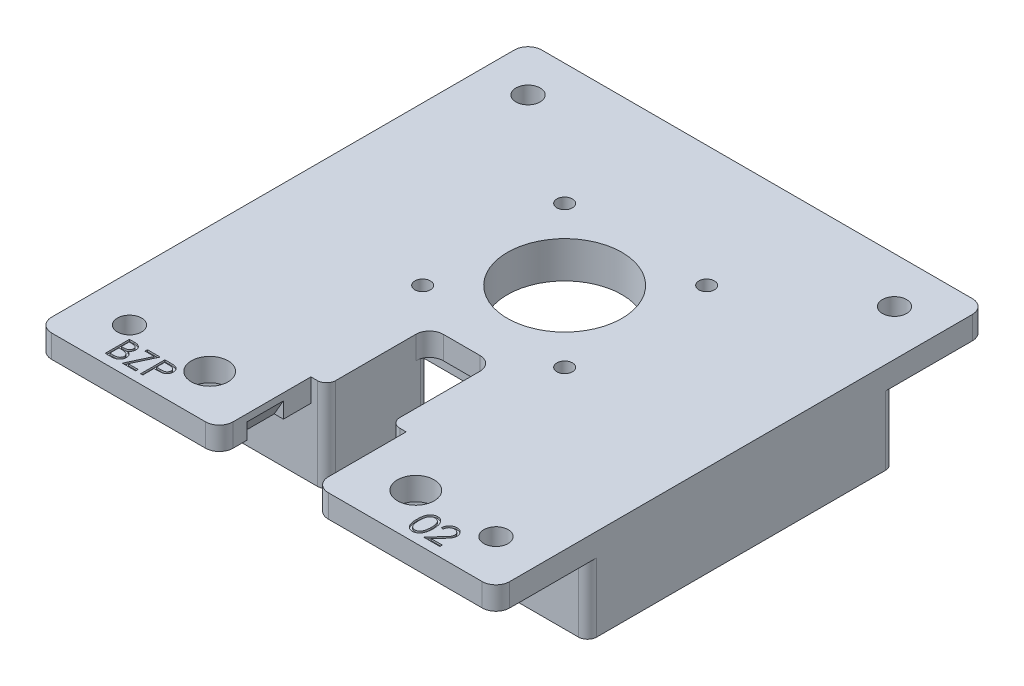
from build123d import *

# Parameters (mm, degrees)
SKETCH2_W               = 100
SKETCH2_H               = 107
BOSS_EXTRUDE1_DEPTH     = 5
CUT_EXTRUDE1_DEPTH      = 147.540096902
CUT_EXTRUDE1_DEPTH_BACK = 20
SKETCH3_R               = 12.5
SKETCH3_R_2             = 1.7
SKETCH3_R_3             = 4
SKETCH12_W              = 42.3
SKETCH12_H              = 42.3
BOSS_EXTRUDE3_DEPTH     = 3
M5_CLEARANCE_HOLE1_D    = 5.3
FILLET1_R               = 3
BOSS_EXTRUDE2_DEPTH     = 15
FILLET3_R               = 3
FILLET4_R               = 2
CUT_EXTRUDE2_DEPTH      = 4
CUT_EXTRUDE2_DEPTH_BACK = 4
CUT_EXTRUDE3_DEPTH      = 0.4
CUT_EXTRUDE4_DEPTH      = 0.4
SKETCH13_R              = 1.7
SKETCH13_R_2            = 12.5
CUT_EXTRUDE5_DEPTH      = 3


with BuildPart() as part:
    # Sketch2 → Boss-Extrude1 (new body)
    with BuildSketch(Plane(origin=(0, 0, 0), x_dir=(1, 0, 0), z_dir=(0, 1, 0))):
        with Locations((50, 53.5)):
            Rectangle(SKETCH2_W, SKETCH2_H)
    extrude(amount=BOSS_EXTRUDE1_DEPTH)

    # Sketch3 → Cut-Extrude1 (cut, two sides: drawn at the far end of the back side and taken through both)
    with BuildSketch(Plane(origin=(0, 5, 0), x_dir=(1, 0, 0), z_dir=(0, 1, 0)).offset(-CUT_EXTRUDE1_DEPTH_BACK)):
        with Locations(Location((50, 65, 0), (0, 0, 90))):
            Circle(SKETCH3_R)
        with Locations(Location((65.5, 49.5, 0), (0, 0, 90))):
            Circle(SKETCH3_R_2)
        with Locations(Location((34.5, 49.5, 0), (0, 0, 90))):
            Circle(SKETCH3_R_2)
        with Locations(Location((65.5, 80.5, 0), (0, 0, 90))):
            Circle(SKETCH3_R_2)
        with Locations(Location((34.5, 80.5, 0), (0, 0, 90))):
            Circle(SKETCH3_R_2)
        with Locations(Location((27.5, 10, 0), (0, 0, 90))):
            Circle(SKETCH3_R_3)
        with Locations(Location((72.5, 10, 0), (0, 0, 90))):
            Circle(SKETCH3_R_3)
        Polygon((39.6, 0), (39.6, 20), (43, 20), (43, 42.5), (57, 42.5), (57, 20), (60.4, 20), (60.4, 0), align=None)
    extrude(amount=CUT_EXTRUDE1_DEPTH + CUT_EXTRUDE1_DEPTH_BACK, mode=Mode.SUBTRACT)

    # Sketch12 → Boss-Extrude3 (add)
    with BuildSketch(Plane.XZ):
        with Locations((50, -65)):
            Rectangle(SKETCH12_W, SKETCH12_H)
    extrude(amount=BOSS_EXTRUDE3_DEPTH)

    # M5 Clearance Hole1 (through all)
    with Locations(Plane(origin=(0, 5, 0), x_dir=(1, 0, 0), z_dir=(0, 1, 0))):
        with Locations((10, 97), (10, 10), (90, 10), (90, 97)):
            Hole(M5_CLEARANCE_HOLE1_D / 2)

    # Fillet1
    fillet1_edges = [part.edges().sort_by_distance(p)[0] for p in [
        (39.6, 2.5, 0),
        (60.4, 2.5, 0),
        (57, 2.5, -42.5),
        (43, 2.5, -42.5),
        (0, 2.5, -107),
        (100, 2.5, -107),
        (100, 2.5, 0),
        (0, 2.5, 0),
    ]]
    fillet(fillet1_edges, radius=FILLET1_R)

    # Sketch7 → Boss-Extrude2 (add)
    with BuildSketch(Plane.XZ):
        Polygon((57, -20), (100, -20), (100, -87), (84, -87), (84, -82), (95, -82), (95, -25), (62, -25), (62, -42.5), (57, -42.5), (57, -25), align=None)
        Polygon((43, -25), (43, -20), (0, -20), (0, -87), (16, -87), (16, -82), (5, -82), (5, -25), (38, -25), (38, -42.5), (43, -42.5), align=None)
    extrude(amount=BOSS_EXTRUDE2_DEPTH)

    # Fillet3
    fillet3_edges = [part.edges().sort_by_distance(p)[0] for p in [
        (62, -7.5, -25),
        (95, -7.5, -25),
        (95, -7.5, -82),
        (5, -7.5, -82),
        (5, -7.5, -25),
        (38, -7.5, -25),
    ]]
    fillet(fillet3_edges, radius=FILLET3_R)

    # Fillet4
    fillet4_edges = [part.edges().sort_by_distance(p)[0] for p in [
        (57, -7.5, -42.5),
        (62, -7.5, -42.5),
        (84, -7.5, -82),
        (84, -7.5, -87),
        (100, -7.5, -87),
        (100, -7.5, -20),
        (43, -7.5, -42.5),
        (0, -7.5, -20),
        (0, -7.5, -87),
        (16, -7.5, -87),
        (16, -7.5, -82),
        (38, -7.5, -42.5),
        (57, -5, -20),
        (43, -5, -20),
    ]]
    fillet(fillet4_edges, radius=FILLET4_R)

    # Sketch9 → Cut-Extrude2 (cut, two sides: drawn at the far end of the back side and taken through both)
    with BuildSketch(Plane.XY.offset(-10).offset(-CUT_EXTRUDE2_DEPTH_BACK)):
        Polygon((39.6, 0), (39.6, 3.464101615), (37.6, 0), align=None)
        Polygon((60.4, 0), (62.4, 0), (60.4, 3.464101615), align=None)
    extrude(amount=CUT_EXTRUDE2_DEPTH + CUT_EXTRUDE2_DEPTH_BACK, mode=Mode.SUBTRACT)

    # Sketch10 → Cut-Extrude3 (cut)
    # profile 1 of 3: a face of its own
    with BuildSketch(Plane(origin=(0, 5, 0), x_dir=(1, 0, 0), z_dir=(0, 1, 0))):
        with BuildLine():
            Line((12.690491453, 7.291666667), (13.722960069, 7.291666667))
            add(Edge.make_bspline(
                [(13.722960069, 7.291666667), (13.773500745, 7.291400949), (13.871461152, 7.290885921), (14.013911975, 7.28289833), (14.147335772, 7.272007068), (14.271771237, 7.254725856), (14.387160871, 7.233874002), (14.493852417, 7.208622447), (14.591506606, 7.178344115), (14.70809372, 7.13019557), (14.841021386, 7.058647447), (14.984952289, 6.952922116), (15.108027746, 6.823605178), (15.214142773, 6.677732592), (15.298508752, 6.517265413), (15.359543285, 6.346028306), (15.398184358, 6.166229958), (15.4021583, 6.042793249), (15.404166667, 5.980410323)],
                knots=[0, 0, 0, 0, 1.001505555, 1.941167018, 2.826882275, 3.653841531, 4.429895133, 5.150066043, 5.825578002, 6.45369114, 7.647487171, 8.808567382, 9.977351308, 11.170798116, 12.373658725, 13.556498008, 14.765093433, 16, 16, 16, 16], degree=3))
            add(Edge.make_bspline(
                [(15.404166667, 5.980410323), (15.402513824, 5.92197134), (15.399265834, 5.807133228), (15.368207138, 5.639169515), (15.31958327, 5.479283743), (15.251993191, 5.328059423), (15.164148507, 5.188913365), (15.060041287, 5.060723093), (14.934437073, 4.948916138), (14.840331222, 4.886409607), (14.792529714, 4.854659121)],
                knots=[0, 0, 0, 0, 1.044552857, 2.05264487, 3.044412934, 4.028983338, 5.005914585, 5.980388656, 6.974128949, 8, 8, 8, 8], degree=3))
            add(Edge.make_bspline(
                [(14.792529714, 4.854659121), (14.852643694, 4.831579897), (14.967656629, 4.787423623), (15.125931909, 4.709355719), (15.262297925, 4.624443957), (15.377803134, 4.531716041), (15.476587446, 4.431765815), (15.56284606, 4.323127725), (15.636447661, 4.204384603), (15.699513629, 4.076774496), (15.748724248, 3.941600431), (15.785578294, 3.800130329), (15.806695747, 3.652871478), (15.809700871, 3.552654297), (15.811217949, 3.502061632)],
                knots=[0, 0, 0, 0, 1.27268992, 2.434971085, 3.483601985, 4.442670788, 5.356604649, 6.2567628, 7.179492994, 8.113709626, 9.066344395, 10.018646069, 10.999752585, 12, 12, 12, 12], degree=3))
            add(Edge.make_bspline(
                [(15.811217949, 3.502061632), (15.809741051, 3.450404575), (15.806835212, 3.348767869), (15.785396445, 3.199459511), (15.749096962, 3.05677358), (15.699096538, 2.919787173), (15.633839229, 2.788765303), (15.55442195, 2.663559534), (15.459728991, 2.545427868), (15.353800605, 2.433057628), (15.23396379, 2.332020378), (15.104672113, 2.242038298), (14.96429732, 2.168036514), (14.8151449, 2.105873005), (14.655541708, 2.058388312), (14.486204433, 2.025167873), (14.307279119, 2.002784067), (14.18449771, 2.000943769), (14.121531116, 2)],
                knots=[0, 0, 0, 0, 0.978564426, 1.925352924, 2.850884081, 3.763762016, 4.682927383, 5.618979971, 6.567305752, 7.547517671, 8.540179244, 9.531824382, 10.526200242, 11.540722885, 12.589160233, 13.674978461, 14.80764778, 16, 16, 16, 16], degree=3))
            Line((14.121531116, 2), (12.690491453, 2))
            Line((12.690491453, 2), (12.690491453, 7.291666667))
        make_face()
        with BuildLine():
            Line((13.165384615, 6.748931624), (13.165384615, 5.052884615))
            Line((13.165384615, 5.052884615), (13.484453459, 5.052884615))
            add(Edge.make_bspline(
                [(13.484453459, 5.052884615), (13.531093899, 5.053489261), (13.621212735, 5.054657559), (13.751720198, 5.058004186), (13.872861595, 5.067375038), (13.984427819, 5.076743196), (14.08624318, 5.091975013), (14.178082114, 5.11010596), (14.261385945, 5.129281305), (14.357451686, 5.161892315), (14.46641912, 5.210088324), (14.582583456, 5.284885029), (14.684991523, 5.373973039), (14.771468224, 5.476768898), (14.842242709, 5.58995944), (14.89140035, 5.711738653), (14.924733744, 5.839071471), (14.92774475, 5.926487163), (14.929273504, 5.970870059)],
                knots=[0, 0, 0, 0, 1.156816544, 2.235205308, 3.236616184, 4.169592532, 5.011045266, 5.787822928, 6.49130361, 7.128639758, 8.301311294, 9.436451833, 10.541879658, 11.654887649, 12.756523258, 13.837046038, 14.901820046, 16, 16, 16, 16], degree=3))
            add(Edge.make_bspline(
                [(14.929273504, 5.970870059), (14.92847797, 6.000239975), (14.926917442, 6.057852274), (14.914136854, 6.141837607), (14.89241445, 6.220825185), (14.864513316, 6.295897471), (14.825523275, 6.364707054), (14.77961661, 6.429633076), (14.72415134, 6.488464493), (14.66101826, 6.543451711), (14.588433795, 6.592202366), (14.506441246, 6.63489971), (14.413931306, 6.669281599), (14.312463061, 6.699392924), (14.200474631, 6.720541893), (14.079258342, 6.738160705), (13.947821326, 6.747130446), (13.856887659, 6.74831784), (13.809882479, 6.748931624)],
                knots=[0, 0, 0, 0, 0.91205012, 1.789085906, 2.630437955, 3.453916878, 4.269457761, 5.079663411, 5.91843418, 6.774407191, 7.675494373, 8.627863946, 9.638891023, 10.736472738, 11.911756761, 13.175263542, 14.539845004, 16, 16, 16, 16], degree=3))
            Line((13.809882479, 6.748931624), (13.165384615, 6.748931624))
        make_face(mode=Mode.SUBTRACT)
        with BuildLine():
            Line((13.165384615, 4.510149573), (13.165384615, 2.542735043))
            Line((13.165384615, 2.542735043), (13.84168336, 2.542735043))
            add(Edge.make_bspline(
                [(13.84168336, 2.542735043), (13.890092927, 2.543315232), (13.983395984, 2.544433471), (14.118108558, 2.548084048), (14.242966346, 2.556387845), (14.357399599, 2.569459547), (14.462643974, 2.583638869), (14.55743693, 2.602705924), (14.642546877, 2.624551377), (14.741235414, 2.658318518), (14.852365718, 2.710776277), (14.972124989, 2.789870406), (15.078602723, 2.884097311), (15.169022579, 2.993152384), (15.24312555, 3.111733081), (15.297033203, 3.237440931), (15.330281284, 3.368198812), (15.33430623, 3.457350865), (15.336324786, 3.502061632)],
                knots=[0, 0, 0, 0, 1.160039823, 2.235823828, 3.228722157, 4.157150951, 4.99529583, 5.772374946, 6.472645482, 7.099169577, 8.269452708, 9.405989375, 10.527446681, 11.663510218, 12.788923519, 13.866172445, 14.929861265, 16, 16, 16, 16], degree=3))
            add(Edge.make_bspline(
                [(15.336324786, 3.502061632), (15.335907343, 3.530021802), (15.335079189, 3.585491141), (15.322589926, 3.667006724), (15.304426099, 3.745967271), (15.280944051, 3.822587188), (15.24674557, 3.895481221), (15.206821389, 3.966091044), (15.160010699, 4.034509995), (15.087070115, 4.121009473), (14.980976757, 4.220669719), (14.830229609, 4.318244276), (14.658821491, 4.396935603), (14.534501353, 4.430347907), (14.470280783, 4.447607839)],
                knots=[0, 0, 0, 0, 0.723448775, 1.435228256, 2.130040452, 2.821711965, 3.505591119, 4.210454504, 4.921174351, 5.648778258, 7.137944449, 8.670945889, 10.280296675, 12, 12, 12, 12], degree=3))
            add(Edge.make_bspline(
                [(14.470280783, 4.447607839), (14.444534411, 4.452831597), (14.388710968, 4.464157782), (14.297682841, 4.476113476), (14.193760753, 4.486764936), (14.076704736, 4.49464371), (13.946366691, 4.502787651), (13.802468254, 4.505954821), (13.645597076, 4.509733464), (13.536751466, 4.510007322), (13.480213341, 4.510149573)],
                knots=[0, 0, 0, 0, 0.634451884, 1.375622551, 2.216452059, 3.157844607, 4.20941857, 5.370758133, 6.634282058, 8, 8, 8, 8], degree=3))
            Line((13.480213341, 4.510149573), (13.165384615, 4.510149573))
        make_face(mode=Mode.SUBTRACT)
    # profile 2 of 3: a face of its own
    with BuildSketch(Plane(origin=(0, 5, 0), x_dir=(1, 0, 0), z_dir=(0, 1, 0))):
        Polygon((16.625320513, 6.748931624), (16.625320513, 7.291666667), (19.406837607, 7.291666667), (17.187136084, 2.542735043), (19.338995726, 2.542735043), (19.338995726, 2), (16.421794872, 2), (18.641496394, 6.748931624), align=None)
    # profile 3 of 3: a face of its own
    with BuildSketch(Plane(origin=(0, 5, 0), x_dir=(1, 0, 0), z_dir=(0, 1, 0))):
        with BuildLine():
            Line((20.424465812, 7.291666667), (21.462234575, 7.291666667))
            add(Edge.make_bspline(
                [(21.462234575, 7.291666667), (21.533612969, 7.291588204), (21.670377142, 7.291437867), (21.866493952, 7.286879859), (22.044611046, 7.280791884), (22.20434436, 7.272352593), (22.346185366, 7.262379177), (22.469492235, 7.248390974), (22.575234184, 7.233785528), (22.638592744, 7.218936496), (22.667487981, 7.212164463)],
                knots=[0, 0, 0, 0, 1.415646017, 2.712440637, 3.8905458, 4.950247383, 5.884950622, 6.709939814, 7.411656543, 8, 8, 8, 8], degree=3))
            add(Edge.make_bspline(
                [(22.667487981, 7.212164463), (22.7040663, 7.202152706), (22.776361015, 7.182365105), (22.88053283, 7.142732452), (22.979644002, 7.095739178), (23.074034572, 7.042181555), (23.162544626, 6.979761714), (23.246494712, 6.911009935), (23.325143968, 6.834338873), (23.39805012, 6.750608468), (23.465004516, 6.661224342), (23.522652965, 6.564852161), (23.570923892, 6.463114119), (23.61232479, 6.356080981), (23.642122096, 6.242853944), (23.664569195, 6.124219748), (23.678816822, 6.00019111), (23.68018141, 5.915433929), (23.680876068, 5.872287326)],
                knots=[0, 0, 0, 0, 0.999701418, 1.975846123, 2.934577507, 3.890451536, 4.834027766, 5.787354733, 6.749476667, 7.726910423, 8.712836071, 9.690891519, 10.682875813, 11.679750201, 12.712814741, 13.765529915, 14.8625177, 16, 16, 16, 16], degree=3))
            add(Edge.make_bspline(
                [(23.680876068, 5.872287326), (23.680238914, 5.828778069), (23.678992279, 5.743649267), (23.664030038, 5.619109456), (23.643876058, 5.500094748), (23.612886467, 5.386869031), (23.572298366, 5.280104711), (23.524685382, 5.178170229), (23.467257901, 5.082799773), (23.401271075, 4.993647107), (23.327865689, 4.910628549), (23.247352318, 4.834345705), (23.160056006, 4.765245098), (23.066254187, 4.703171817), (22.965032392, 4.649565299), (22.857925803, 4.601551279), (22.744003452, 4.561227175), (22.665168937, 4.540015058), (22.625086806, 4.529230101)],
                knots=[0, 0, 0, 0, 1.121902311, 2.195077645, 3.232258892, 4.234102512, 5.217864754, 6.176164875, 7.132989551, 8.084763148, 9.034132444, 9.988522005, 10.94243251, 11.903244335, 12.886203696, 13.894208494, 14.929344452, 16, 16, 16, 16], degree=3))
            add(Edge.make_bspline(
                [(22.625086806, 4.529230101), (22.591934765, 4.522180118), (22.51928014, 4.50672967), (22.399623882, 4.48948117), (22.260308834, 4.474758845), (22.101525149, 4.46372022), (21.923415352, 4.454270258), (21.725883094, 4.446758973), (21.50854062, 4.442631694), (21.356940049, 4.442418829), (21.277789463, 4.442307692)],
                knots=[0, 0, 0, 0, 0.601384939, 1.31797006, 2.144135048, 3.087295005, 4.142315834, 5.309527816, 6.595305764, 8, 8, 8, 8], degree=3))
            Line((21.277789463, 4.442307692), (20.899358974, 4.442307692))
            Line((20.899358974, 4.442307692), (20.899358974, 2))
            Line((20.899358974, 2), (20.424465812, 2))
            Line((20.424465812, 2), (20.424465812, 7.291666667))
        make_face()
        with BuildLine():
            Line((20.899358974, 6.748931624), (20.899358974, 4.985042735))
            Line((20.899358974, 4.985042735), (21.825824653, 4.973382412))
            add(Edge.make_bspline(
                [(21.825824653, 4.973382412), (21.871060731, 4.973359032), (21.958388048, 4.973313899), (22.084535671, 4.979339177), (22.201571141, 4.986294744), (22.309134963, 4.996478819), (22.407275626, 5.010874054), (22.496156771, 5.025406086), (22.575089211, 5.04642967), (22.667465385, 5.074737167), (22.770400922, 5.123016241), (22.882384001, 5.19309286), (22.97728715, 5.282417265), (23.059411241, 5.382849819), (23.124583223, 5.494578265), (23.172292878, 5.614122967), (23.200325342, 5.74025793), (23.20408423, 5.826569759), (23.205982906, 5.870167268)],
                knots=[0, 0, 0, 0, 1.160613943, 2.240541288, 3.23993089, 4.169200891, 5.011653406, 5.7853311, 6.478053781, 7.106038997, 8.262395093, 9.384106736, 10.481365981, 11.59014053, 12.70357646, 13.786202915, 14.881775077, 16, 16, 16, 16], degree=3))
            add(Edge.make_bspline(
                [(23.205982906, 5.870167268), (23.204073905, 5.91271002), (23.200279047, 5.997279747), (23.172073158, 6.121223825), (23.124675981, 6.239508759), (23.058973749, 6.349837114), (22.979234184, 6.449908282), (22.886555415, 6.536838463), (22.781155603, 6.606721275), (22.683111254, 6.651826356), (22.596023746, 6.679366117), (22.520380188, 6.698635102), (22.434971668, 6.71401965), (22.339770382, 6.726476993), (22.235514217, 6.737141155), (22.121307479, 6.744377097), (21.997582804, 6.748612632), (21.911690631, 6.748822719), (21.867165799, 6.748931624)],
                knots=[0, 0, 0, 0, 1.120700087, 2.227813068, 3.331159281, 4.466773991, 5.599788987, 6.693661531, 7.80175334, 8.91857717, 9.525282508, 10.207424825, 10.974604443, 11.810962634, 12.737642355, 13.736264703, 14.826523623, 16, 16, 16, 16], degree=3))
            Line((21.867165799, 6.748931624), (20.899358974, 6.748931624))
        make_face(mode=Mode.SUBTRACT)
    extrude(amount=-CUT_EXTRUDE3_DEPTH, mode=Mode.SUBTRACT)

    # Sketch11 → Cut-Extrude4 (cut)
    # profile 1 of 2: a face of its own
    with BuildSketch(Plane(origin=(0, 5, 0), x_dir=(1, 0, 0), z_dir=(0, 1, 0))):
        with BuildLine():
            add(Edge.make_bspline(
                [(78.083012821, 4.643713275), (78.083508753, 4.728527182), (78.084472108, 4.89327942), (78.095189126, 5.133346677), (78.112992322, 5.358560447), (78.137390493, 5.568931511), (78.167081248, 5.764514179), (78.206716567, 5.944785776), (78.251790686, 6.110580657), (78.304030693, 6.262439469), (78.362976517, 6.402408139), (78.427133078, 6.533074812), (78.499046517, 6.654241781), (78.57460685, 6.767842965), (78.65687272, 6.872018789), (78.743503034, 6.968240433), (78.837878966, 7.054284068), (78.936792324, 7.132670739), (79.041138645, 7.201386012), (79.147943628, 7.2619117), (79.257942419, 7.313618642), (79.371435339, 7.35427442), (79.487402301, 7.387855105), (79.606248699, 7.410819348), (79.728170762, 7.425268483), (79.810465907, 7.426649862), (79.852201856, 7.427350427)],
                knots=[0, 0, 0, 0, 1.646270934, 3.197905019, 4.663502075, 6.030701355, 7.308322542, 8.50163776, 9.611534131, 10.641858119, 11.616356847, 12.558055219, 13.465016945, 14.349605745, 15.204443733, 16.039544428, 16.859896111, 17.680448484, 18.487036065, 19.28249412, 20.06191084, 20.843045899, 21.620316918, 22.403196591, 23.190181807, 24, 24, 24, 24], degree=3))
            add(Edge.make_bspline(
                [(79.852201856, 7.427350427), (79.894286449, 7.426612897), (79.977979462, 7.425146182), (80.101714315, 7.411049269), (80.22259062, 7.387658404), (80.340093044, 7.354515978), (80.455186773, 7.313398705), (80.56697158, 7.261862231), (80.676141811, 7.201871562), (80.780962603, 7.1313807), (80.8825847, 7.052788449), (80.978511977, 6.96394489), (81.068753166, 6.8657471), (81.15444083, 6.759245711), (81.233143936, 6.642398023), (81.308094244, 6.517236333), (81.375180536, 6.381571812), (81.439791295, 6.237668009), (81.495560906, 6.081543192), (81.545856301, 5.914077423), (81.586494741, 5.73329264), (81.620345189, 5.540137365), (81.64656902, 5.333902241), (81.665668371, 5.115029359), (81.67575744, 4.883374721), (81.677657453, 4.72499083), (81.678632479, 4.643713275)],
                knots=[0, 0, 0, 0, 0.810914788, 1.612654377, 2.396697861, 3.181598691, 3.963628158, 4.749916497, 5.551656086, 6.361998678, 7.18212741, 8.025565596, 8.878627764, 9.750805457, 10.657531673, 11.591944965, 12.560506719, 13.57287815, 14.630710178, 15.753379473, 16.941251878, 18.199788006, 19.531962791, 20.947069417, 22.433333509, 24, 24, 24, 24], degree=3))
            add(Edge.make_bspline(
                [(81.678632479, 4.643713275), (81.677647345, 4.562790223), (81.675727852, 4.405114958), (81.665781474, 4.17450265), (81.646189258, 3.956791323), (81.621681299, 3.751458838), (81.587737581, 3.559359819), (81.546001199, 3.379829522), (81.49966083, 3.212092651), (81.442458225, 3.057523353), (81.379849174, 2.913965391), (81.311730009, 2.779909107), (81.238750629, 2.654169593), (81.159241455, 2.537753309), (81.074494032, 2.429835578), (80.982694518, 2.332321315), (80.886430658, 2.242860894), (80.784509505, 2.163256648), (80.678053946, 2.093580812), (80.569258674, 2.031269396), (80.456193321, 1.981024726), (80.341420166, 1.937882461), (80.223297518, 1.904922254), (80.101972617, 1.88213202), (79.978062594, 1.866148392), (79.894300704, 1.864929072), (79.852201856, 1.864316239)],
                knots=[0, 0, 0, 0, 1.561518951, 3.042555995, 4.452378317, 5.7783523, 7.031515105, 8.214008947, 9.334062868, 10.386615937, 11.391082383, 12.354592575, 13.286541444, 14.194233754, 15.072674879, 15.931287219, 16.775624067, 17.606195743, 18.42308326, 19.229000347, 20.022332153, 20.807536673, 21.593273796, 22.3848459, 23.188221202, 24, 24, 24, 24], degree=3))
            add(Edge.make_bspline(
                [(79.852201856, 1.864316239), (79.810467065, 1.865021324), (79.728174202, 1.866411614), (79.606235416, 1.88079547), (79.487879817, 1.903920815), (79.372523368, 1.93630068), (79.259574232, 1.975935016), (79.150571513, 2.027572133), (79.044303229, 2.087041499), (78.9410529, 2.15476791), (78.842760705, 2.232361407), (78.748873527, 2.318183606), (78.661749987, 2.414376144), (78.580660342, 2.519420147), (78.503592375, 2.632349216), (78.432700109, 2.754705208), (78.367127508, 2.886002965), (78.307190326, 3.027090758), (78.254048894, 3.180027375), (78.207107716, 3.346562443), (78.170044645, 3.528165845), (78.138320415, 3.723379007), (78.112732359, 3.933040783), (78.09526332, 4.157264995), (78.084466332, 4.395911918), (78.083506166, 4.559605505), (78.083012821, 4.643713275)],
                knots=[0, 0, 0, 0, 0.810891512, 1.598919785, 2.382837074, 3.152667961, 3.926044502, 4.706494248, 5.493654104, 6.291793342, 7.103789334, 7.925228297, 8.761435821, 9.622817696, 10.50288917, 11.416980706, 12.369136599, 13.353924996, 14.394355917, 15.514179734, 16.714354668, 17.994756427, 19.357759367, 20.818452758, 22.365282078, 24, 24, 24, 24], degree=3))
        make_face()
        with BuildLine():
            add(Edge.make_bspline(
                [(78.557905983, 4.645833333), (78.558086575, 4.575153753), (78.55843707, 4.437978566), (78.567593469, 4.238644112), (78.580067034, 4.052724686), (78.596155662, 3.879984221), (78.620048215, 3.721007416), (78.646819192, 3.574700871), (78.679397851, 3.441838858), (78.71794389, 3.321509668), (78.761848239, 3.211671195), (78.809784485, 3.109464596), (78.861281054, 3.013682502), (78.918913579, 2.925185261), (78.981680401, 2.843684275), (79.048163781, 2.767737016), (79.12084495, 2.700008247), (79.221392275, 2.618778359), (79.354132183, 2.534838716), (79.521379776, 2.461744033), (79.693235648, 2.415808652), (79.809880991, 2.409967021), (79.868102297, 2.407051282)],
                knots=[0, 0, 0, 0, 1.459021318, 2.831673884, 4.118529203, 5.306027144, 6.411944654, 7.436330062, 8.375795394, 9.233974572, 10.042671642, 10.816086306, 11.563610507, 12.285937304, 12.993564865, 13.685989202, 14.367179055, 15.041617293, 16.353048772, 17.594441528, 18.799311195, 20, 20, 20, 20], degree=3))
            add(Edge.make_bspline(
                [(79.868102297, 2.407051282), (79.926700205, 2.409466974), (80.043775039, 2.414293372), (80.214822563, 2.460858129), (80.380875471, 2.531115647), (80.511008048, 2.614191043), (80.610011417, 2.693306493), (80.680945438, 2.760759592), (80.746051154, 2.836288106), (80.807800481, 2.917778708), (80.864435036, 3.006788297), (80.915935256, 3.102888858), (80.962930317, 3.206347257), (80.989704708, 3.278570554), (81.003393763, 3.315496461)],
                knots=[0, 0, 0, 0, 1.353760809, 2.704726607, 4.075137775, 5.516104923, 6.260822281, 7.007110065, 7.778089737, 8.566572457, 9.372053459, 10.217411131, 11.088608312, 12, 12, 12, 12], degree=3))
            add(Edge.make_bspline(
                [(81.003393763, 3.315496461), (81.019347031, 3.362712853), (81.051739007, 3.458582377), (81.09348538, 3.607298851), (81.126362353, 3.763331602), (81.155940298, 3.925748147), (81.176128847, 4.095746266), (81.192378517, 4.272799966), (81.201949913, 4.45704274), (81.203136382, 4.582220881), (81.203739316, 4.645833333)],
                knots=[0, 0, 0, 0, 0.884706709, 1.796334032, 2.740027952, 3.714592787, 4.726048262, 5.777819803, 6.87074269, 8, 8, 8, 8], degree=3))
            add(Edge.make_bspline(
                [(81.203739316, 4.645833333), (81.202907483, 4.709435497), (81.201280238, 4.833854924), (81.19506028, 5.016066935), (81.178998447, 5.189131288), (81.161159303, 5.353793551), (81.134856362, 5.509142222), (81.106496345, 5.656477803), (81.068394512, 5.793974995), (81.027694376, 5.923786506), (80.981111992, 6.044437495), (80.929834632, 6.156490482), (80.875070782, 6.260486435), (80.815589062, 6.356140025), (80.752095588, 6.443879703), (80.682914532, 6.521946292), (80.610790063, 6.592759327), (80.509768842, 6.67358964), (80.377516047, 6.756006132), (80.212951794, 6.831851984), (80.041697368, 6.875407378), (79.925925598, 6.881548262), (79.868102297, 6.884615385)],
                knots=[0, 0, 0, 0, 1.31362396, 2.569729283, 3.763502607, 4.902122613, 5.988968491, 7.01645872, 7.998833611, 8.933434873, 9.825090667, 10.667526885, 11.477055099, 12.250526234, 12.991942729, 13.710640831, 14.402115721, 15.076753259, 16.378508321, 17.609869233, 18.806226677, 20, 20, 20, 20], degree=3))
            add(Edge.make_bspline(
                [(79.868102297, 6.884615385), (79.809575568, 6.881544031), (79.69241549, 6.875395728), (79.519381082, 6.832014261), (79.35351855, 6.75639942), (79.221615482, 6.673316666), (79.120523804, 6.594186124), (79.049339256, 6.525566128), (78.982594448, 6.450505719), (78.921108759, 6.368255205), (78.86352139, 6.279861138), (78.81063343, 6.184628125), (78.76298223, 6.082073562), (78.719009181, 5.972284428), (78.680345561, 5.851965619), (78.648453497, 5.719267259), (78.618990929, 5.573426066), (78.598133796, 5.413588238), (78.579592165, 5.240804506), (78.567676318, 5.054420942), (78.558406441, 4.854752176), (78.558076143, 4.716867734), (78.557905983, 4.645833333)],
                knots=[0, 0, 0, 0, 1.207732386, 2.417664972, 3.655092373, 4.956220595, 5.625982001, 6.301752483, 6.994047911, 7.697131622, 8.419323945, 9.170223765, 9.943494443, 10.752040957, 11.610060368, 12.549350801, 13.567764191, 14.679664412, 15.874934091, 17.154273443, 18.533957287, 20, 20, 20, 20], degree=3))
        make_face(mode=Mode.SUBTRACT)
    # profile 2 of 2: a face of its own
    with BuildSketch(Plane(origin=(0, 5, 0), x_dir=(1, 0, 0), z_dir=(0, 1, 0))):
        with BuildLine():
            Line((82.831944444, 5.663461538), (82.357051282, 5.663461538))
            add(Edge.make_bspline(
                [(82.357051282, 5.663461538), (82.360146382, 5.726463952), (82.366225077, 5.850199016), (82.394691657, 6.030605398), (82.435423698, 6.203045391), (82.493014349, 6.366134428), (82.564536935, 6.521314529), (82.650307334, 6.667969315), (82.751898036, 6.805539327), (82.86711536, 6.932749244), (82.99225366, 7.0494495), (83.127275735, 7.150225879), (83.269160479, 7.235372835), (83.417477427, 7.306555188), (83.573899946, 7.35998567), (83.737008552, 7.399630292), (83.907519866, 7.423482624), (84.023694661, 7.42604649), (84.082779113, 7.427350427)],
                knots=[0, 0, 0, 0, 1.10065271, 2.161652631, 3.183658789, 4.190468796, 5.17591951, 6.163126047, 7.15150782, 8.156236427, 9.156009102, 10.134482811, 11.092018607, 12.041330605, 13.001268258, 13.972401359, 14.968799086, 16, 16, 16, 16], degree=3))
            add(Edge.make_bspline(
                [(84.082779113, 7.427350427), (84.140803106, 7.425992047), (84.25481818, 7.423322877), (84.421221463, 7.400400845), (84.579634754, 7.364499772), (84.729748401, 7.314130035), (84.870364713, 7.246420246), (85.00254003, 7.165083492), (85.127847923, 7.071013032), (85.240646274, 6.960260243), (85.344223965, 6.842025685), (85.433580946, 6.715799926), (85.510103229, 6.585429459), (85.573886983, 6.449920154), (85.620840908, 6.307996099), (85.656488913, 6.161723542), (85.676638693, 6.009588411), (85.679731178, 5.906617786), (85.681303419, 5.854266827)],
                knots=[0, 0, 0, 0, 1.111607364, 2.184268762, 3.212621178, 4.221274766, 5.211760367, 6.196651075, 7.1921475, 8.207485113, 9.220403448, 10.201281604, 11.166441695, 12.114753415, 13.065576456, 14.026450734, 14.996634279, 16, 16, 16, 16], degree=3))
            add(Edge.make_bspline(
                [(85.681303419, 5.854266827), (85.678743367, 5.780564744), (85.673668188, 5.634453944), (85.630254785, 5.419740997), (85.562451131, 5.211712852), (85.48081227, 5.044288597), (85.398455123, 4.909376053), (85.324239486, 4.798298368), (85.237358165, 4.678698434), (85.136546626, 4.550976745), (85.02389026, 4.414132877), (84.898368656, 4.268249496), (84.759086725, 4.114833844), (84.66132923, 4.010050375), (84.610673745, 3.955754207)],
                knots=[0, 0, 0, 0, 1.184426356, 2.348067706, 3.509069118, 4.696110526, 5.333549288, 6.050745305, 6.844228056, 7.710549037, 8.667450064, 9.695053472, 10.805634456, 12, 12, 12, 12], degree=3))
            Line((84.610673745, 3.955754207), (83.286697049, 2.542735043))
            Line((83.286697049, 2.542735043), (85.749145299, 2.542735043))
            Line((85.749145299, 2.542735043), (85.749145299, 2))
            Line((85.749145299, 2), (82.153525641, 2))
            Line((82.153525641, 2), (84.205742521, 4.1900207))
            add(Edge.make_bspline(
                [(84.205742521, 4.1900207), (84.255707779, 4.242178854), (84.351680813, 4.342363993), (84.487423518, 4.488630135), (84.609341989, 4.624322893), (84.718225428, 4.749185889), (84.811711799, 4.865045521), (84.894673388, 4.968149418), (84.961145174, 5.063028171), (85.033286308, 5.173005051), (85.103157446, 5.307280816), (85.163198747, 5.471373418), (85.199809291, 5.640294383), (85.204201126, 5.754446273), (85.206410256, 5.811865652)],
                knots=[0, 0, 0, 0, 1.329631726, 2.553950428, 3.673215718, 4.687767853, 5.603093632, 6.413772471, 7.123043292, 7.734684054, 8.834405432, 9.900288307, 10.943827018, 12, 12, 12, 12], degree=3))
            add(Edge.make_bspline(
                [(85.206410256, 5.811865652), (85.205449075, 5.847972052), (85.20355477, 5.919130833), (85.186836584, 6.023460968), (85.161571891, 6.124100627), (85.125368941, 6.221359373), (85.07758256, 6.314259347), (85.019414474, 6.402913632), (84.952300926, 6.488621949), (84.874662697, 6.568984673), (84.789373851, 6.64258602), (84.699273022, 6.70778553), (84.603947269, 6.762273233), (84.503798513, 6.806940187), (84.399105958, 6.841979156), (84.289667117, 6.866258199), (84.175784378, 6.881501954), (84.098021831, 6.883564452), (84.058398438, 6.884615385)],
                knots=[0, 0, 0, 0, 0.991446411, 1.95395049, 2.89581595, 3.838931463, 4.798493298, 5.75982156, 6.748411868, 7.785213223, 8.824556874, 9.840280684, 10.836137867, 11.835679398, 12.848801643, 13.863922112, 14.911575587, 16, 16, 16, 16], degree=3))
            add(Edge.make_bspline(
                [(84.058398438, 6.884615385), (84.017016345, 6.883534324), (83.935748748, 6.881411299), (83.816430687, 6.866560367), (83.702605761, 6.84093987), (83.593987646, 6.805898946), (83.490392558, 6.761360425), (83.392324301, 6.705886002), (83.300003028, 6.63968953), (83.213255189, 6.564637737), (83.133329887, 6.481078387), (83.063106635, 6.387929991), (83.00174747, 6.286893303), (82.948212082, 6.178240947), (82.904736217, 6.060987018), (82.871514906, 5.93554775), (82.84522765, 5.802467804), (82.83644572, 5.710566545), (82.831944444, 5.663461538)],
                knots=[0, 0, 0, 0, 1.031018746, 2.02475058, 2.990194455, 3.934040569, 4.864654155, 5.795059489, 6.735614925, 7.690564532, 8.649604399, 9.611025574, 10.590972636, 11.591080095, 12.624614302, 13.701020113, 14.821632451, 16, 16, 16, 16], degree=3))
        make_face()
    extrude(amount=-CUT_EXTRUDE4_DEPTH, mode=Mode.SUBTRACT)

    # Sketch13 → Cut-Extrude5 (cut)
    with BuildSketch(Plane(origin=(0, 0, 0), x_dir=(1, 0, 0), z_dir=(0, 1, 0))):
        with Locations(Location((34.5, 80.5, 0), (0, 0, 90))):
            Circle(SKETCH13_R)
        with Locations(Location((65.5, 80.5, 0), (0, 0, 90))):
            Circle(SKETCH13_R)
        with Locations(Location((65.5, 49.5, 0), (0, 0, 90))):
            Circle(SKETCH13_R)
        with Locations(Location((34.5, 49.5, 0), (0, 0, 90))):
            Circle(SKETCH13_R)
        with Locations(Location((50, 65, 0), (0, 0, 90))):
            Circle(SKETCH13_R_2)
    extrude(amount=-CUT_EXTRUDE5_DEPTH, mode=Mode.SUBTRACT)


solid = part.part
